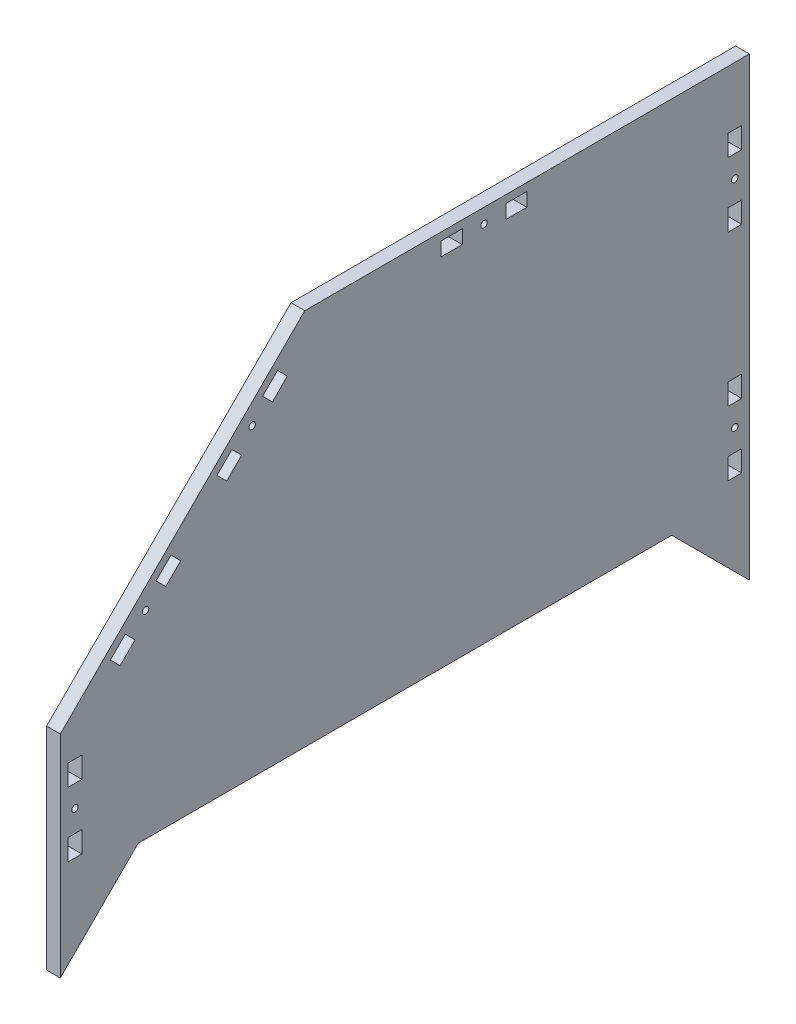
from build123d import *

# Parameters (mm, degrees)
SKETCH1_R           = 1.5
SKETCH1_W           = 6.4
SKETCH1_H           = 9.8
SKETCH1_W_2         = 9.8
SKETCH1_H_2         = 6.4
BOSS_EXTRUDE1_DEPTH = 6.4


with BuildPart() as part:
    # Sketch1 → Boss-Extrude1 (new body)
    with BuildSketch(Plane(origin=(0, 0, 0), x_dir=(0, 0, -1), z_dir=(1, 0, 0))):
        Polygon((-132.823391234, 28.785955079), (114.976608766, 28.785955079), (151.076608766, -7.314044921), (151.076608766, 204.295266909), (-55.414079404, 204.295266909), (-168.923391234, 90.785955079), (-168.923391234, -7.314044921), align=None)
        with Locations((144.275039161, 57.480587849)):
            Circle(SKETCH1_R, mode=Mode.SUBTRACT)
        with Locations((144.275039161, 157.480587849)):
            Circle(SKETCH1_R, mode=Mode.SUBTRACT)
        with Locations((27.831264681, 197.495266909)):
            Circle(SKETCH1_R, mode=Mode.SUBTRACT)
        with Locations((-79.85274236, 170.239957095)):
            Circle(SKETCH1_R, mode=Mode.SUBTRACT)
        with Locations((-129.350217044, 120.742482412)):
            Circle(SKETCH1_R, mode=Mode.SUBTRACT)
        with Locations((-162.121821629, 57.480587849)):
            Circle(SKETCH1_R, mode=Mode.SUBTRACT)
        with Locations((144.275039161, 142.480587849)):
            Rectangle(SKETCH1_W, SKETCH1_H, mode=Mode.SUBTRACT)
        with Locations((144.275039161, 172.480587849)):
            Rectangle(SKETCH1_W, SKETCH1_H, mode=Mode.SUBTRACT)
        with Locations((144.275039161, 72.480587849)):
            Rectangle(SKETCH1_W, SKETCH1_H, mode=Mode.SUBTRACT)
        with Locations((144.275039161, 42.480587849)):
            Rectangle(SKETCH1_W, SKETCH1_H, mode=Mode.SUBTRACT)
        with Locations((42.831264681, 197.495266909)):
            Rectangle(SKETCH1_W_2, SKETCH1_H_2, mode=Mode.SUBTRACT)
        with Locations((12.831264681, 197.495266909)):
            Rectangle(SKETCH1_W_2, SKETCH1_H_2, mode=Mode.SUBTRACT)
        Polygon((-68.044023742, 186.574153746), (-63.518540343, 182.048670346), (-70.448186798, 175.119023891), (-74.973670198, 179.64450729), align=None, mode=Mode.SUBTRACT)
        Polygon((-96.186873634, 158.431303855), (-89.257227178, 165.36095031), (-84.731743778, 160.835466911), (-91.661390234, 153.905820455), align=None, mode=Mode.SUBTRACT)
        Polygon((-113.016080404, 132.551130285), (-117.541563803, 137.076613685), (-124.471210259, 130.146967229), (-119.945726859, 125.62148383), align=None, mode=Mode.SUBTRACT)
        Polygon((-138.754767239, 115.863410249), (-145.684413695, 108.933763794), (-141.158930295, 104.408280394), (-134.229283839, 111.33792685), align=None, mode=Mode.SUBTRACT)
        with Locations((-162.121821629, 42.480587849)):
            Rectangle(SKETCH1_W, SKETCH1_H, mode=Mode.SUBTRACT)
        with Locations((-162.121821629, 72.480587849)):
            Rectangle(SKETCH1_W, SKETCH1_H, mode=Mode.SUBTRACT)
    extrude(amount=BOSS_EXTRUDE1_DEPTH)


solid = part.part
